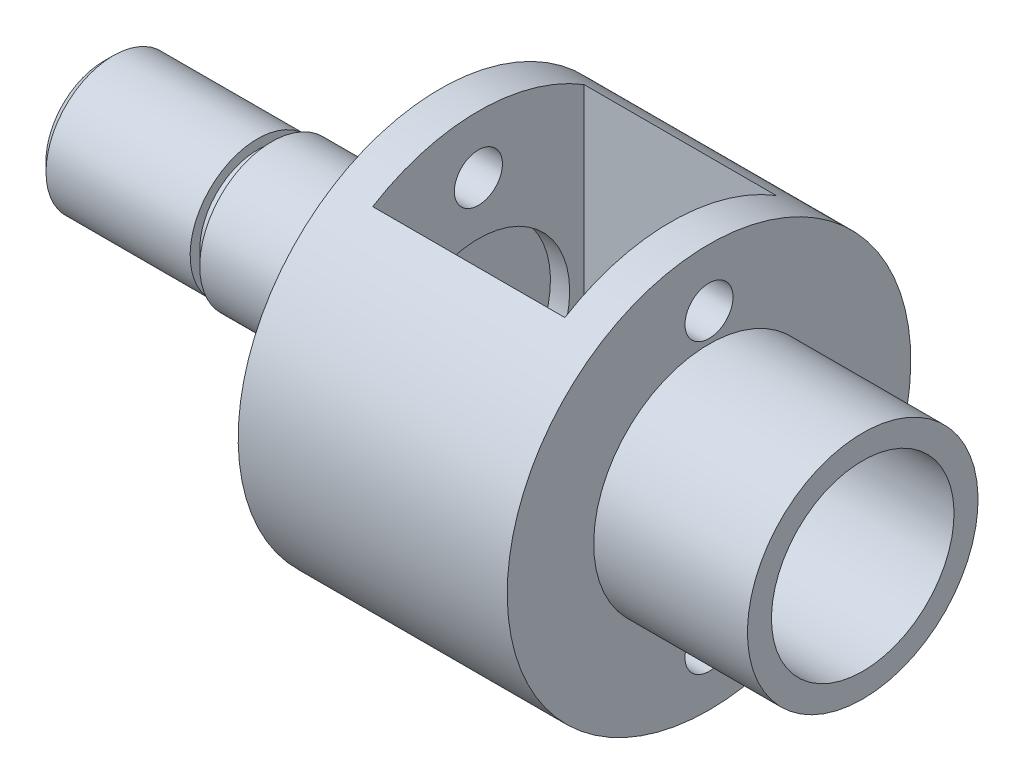
from build123d import *

# Parameters (mm, degrees)
F_2_5_2_5_DIAMETER_HOLE1_D     = 2.5
CUT_EXTRUDE1_REACH             = 44.199
SKETCH3_W                      = 10
SKETCH3_H                      = 11
CUT_EXTRUDE1_DIRECTION_2_REACH = 44.199
CHAMFER1_SIZE                  = 0.5


with BuildPart() as part:
    # Sketch2 → Revolve1 (revolve)
    with BuildSketch(Plane.XY, mode=Mode.PRIVATE) as revolve1_sk:
        Polygon((0, 4.75), (0, 6), (-8, 6), (-8, 10.5), (-22, 10.5), (-22, 6), (-24.5, 6), (-24.5, 3.75), (-30.75, 3.75), (-30.75, 3), (-31.5, 3), (-31.5, 3.5), (-39.5, 3.5), (-39.5, 0), (-21, 0), (-21, 4.75), align=None)
    revolve(revolve1_sk.sketch.rotate(Axis((-21, 0, 0), (1, 0, 0)), 180), axis=Axis((-21, 0, 0), (1, 0, 0)))

    # Ø2.5 (2.5) Diameter Hole1 (through all)
    with Locations(Plane(origin=(-8, 0, 0), x_dir=(0, 0, -1), z_dir=(1, 0, 0))):
        with Locations((0, 7.5), (0, -7.5)):
            Hole(F_2_5_2_5_DIAMETER_HOLE1_D / 2)

    # Sketch3 → Cut-Extrude1 (cut, up to next)
    with BuildSketch(Plane(origin=(0, 0, 0), x_dir=(1, 0, 0), z_dir=(0, 1, 0)), mode=Mode.PRIVATE) as cut_extrude1_sk1:
        with Locations((-15, 0)):
            Rectangle(SKETCH3_W, SKETCH3_H)
    cut_extrude1_tool1 = extrude(cut_extrude1_sk1.sketch, amount=-CUT_EXTRUDE1_REACH, mode=Mode.PRIVATE) & part.part
    add(cut_extrude1_tool1.solids().sort_by_distance((-15, 0, 0))[0], mode=Mode.SUBTRACT)

    # Sketch3 → Cut-Extrude1 direction 2 (cut, up to next)
    with BuildSketch(Plane(origin=(0, 0, 0), x_dir=(1, 0, 0), z_dir=(0, 1, 0)), mode=Mode.PRIVATE) as cut_extrude1_direction_2_sk1:
        with Locations((-15, 0)):
            Rectangle(SKETCH3_W, SKETCH3_H)
    cut_extrude1_direction_2_tool1 = extrude(cut_extrude1_direction_2_sk1.sketch, amount=CUT_EXTRUDE1_DIRECTION_2_REACH, mode=Mode.PRIVATE) & part.part
    add(cut_extrude1_direction_2_tool1.solids().sort_by_distance((-15, 0, 0))[0], mode=Mode.SUBTRACT)

    # Chamfer1
    chamfer1_edges = [part.edges().sort_by_distance(p)[0] for p in [
        (-39.5, 3.5, 0),
    ]]
    chamfer(chamfer1_edges, length=CHAMFER1_SIZE)


solid = part.part
